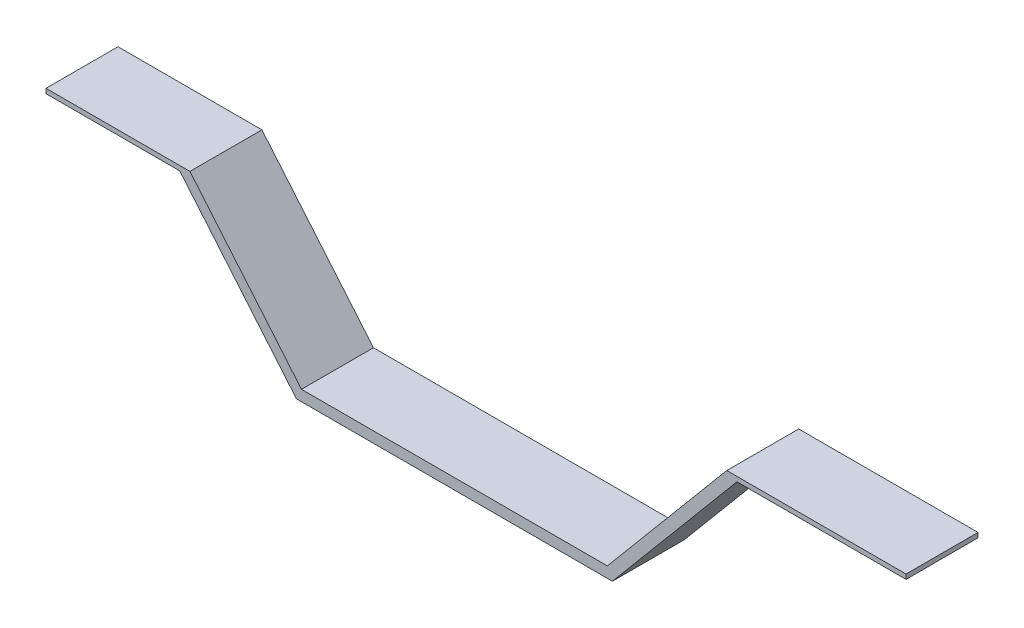
from build123d import *

# Parameters (mm, degrees)
BOSS_EXTRUDE1_DEPTH = 20


with BuildPart() as part:
    # Sketch1 → Boss-Extrude1 (new body)
    with BuildSketch(Plane.XY):
        Polygon((-176.925616004, 29.588970737), (-136.925616004, 29.588970737), (-105.925616004, -7.355390633), (-20.925616004, -7.355390633), (12.259627032, 32.193241976), (62.074383996, 32.193241976), (62.074383996, 30.893241976), (15.085019379, 30.893241976), (-19.52669303, -10.355390633), (-107.324538979, -10.355390633), (-139.751008352, 28.288970737), (-176.925616004, 28.288970737), align=None)
    extrude(amount=BOSS_EXTRUDE1_DEPTH)


solid = part.part
